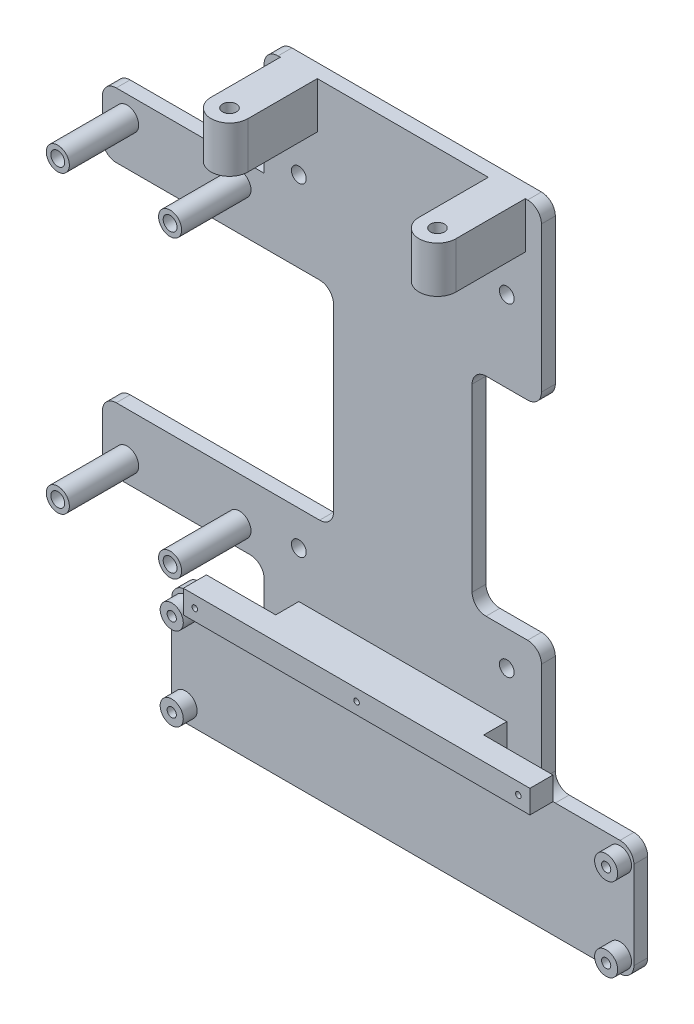
from build123d import *

# Parameters (mm, degrees)
SKETCH_1_W          = 60
SKETCH_1_H          = 100
EXTRUDE_1_DEPTH     = 3
CUT_EXTRUDE_1_REACH = 118.658
SKETCH_2_R          = 1.6
SKETCH_3_W          = 100
SKETCH_3_H          = 25
EXTRUDE_2_DEPTH     = 3
SKETCH_4_R          = 2.5
EXTRUDE_3_DEPTH     = 3
SKETCH_5_R          = 1
CUT_EXTRUDE_2_DEPTH = 129.202964084
SKETCH_6_W          = 45
SKETCH_6_H          = 5
EXTRUDE_4_DEPTH     = 5
SKETCH_7_W          = 75
SKETCH_7_H          = 5
EXTRUDE_5_DEPTH     = 5
SKETCH_8_R          = 0.6
CUT_EXTRUDE_3_DEPTH = 5
SKETCH_9_W          = 35
SKETCH_9_H          = 73
EXTRUDE_6_DEPTH     = 3
SKETCH_10_R         = 2.5
EXTRUDE_7_DEPTH     = 15
SKETCH_11_R         = 1.5
CUT_EXTRUDE_4_DEPTH = 10
SKETCH_12_W         = 60
SKETCH_12_H         = 10
EXTRUDE_8_DEPTH     = 28
CUT_EXTRUDE_5_REACH = 153.026
CUT_EXTRUDE_6_REACH = 160.458
SKETCH_14_R         = 1.5
CUT_EXTRUDE_7_REACH = 139.335
SKETCH_15_W         = 50
SKETCH_15_H         = 45
SKETCH_15_W_2       = 15
FILLET_1_R          = 3
FILLET_2_R          = 3
FILLET_3_R          = 3
FILLET_4_R          = 3
FILLET_5_R          = 3
FILLET_6_R          = 3


with BuildPart() as part:
    # 草图1 → 凸台-拉伸1 (new body)
    with BuildSketch(Plane.XY):
        with Locations((30, 50)):
            Rectangle(SKETCH_1_W, SKETCH_1_H)
    extrude(amount=EXTRUDE_1_DEPTH)

    # 草图2 → 切除-拉伸1 (cut, up to next)
    with BuildSketch(Plane.XY.offset(3), mode=Mode.PRIVATE) as cut_extrude_1_sk1:
        with Locations((7.5, 90)):
            Circle(SKETCH_2_R)
    cut_extrude_1_tool1 = extrude(cut_extrude_1_sk1.sketch, amount=-CUT_EXTRUDE_1_REACH, mode=Mode.PRIVATE) & part.part
    # 草图2 → 切除-拉伸1 (cut, up to next)
    with BuildSketch(Plane.XY.offset(3), mode=Mode.PRIVATE) as cut_extrude_1_sk2:
        with Locations((52.5, 90)):
            Circle(SKETCH_2_R)
    cut_extrude_1_tool2 = extrude(cut_extrude_1_sk2.sketch, amount=-CUT_EXTRUDE_1_REACH, mode=Mode.PRIVATE) & part.part
    # 草图2 → 切除-拉伸1 (cut, up to next)
    with BuildSketch(Plane.XY.offset(3), mode=Mode.PRIVATE) as cut_extrude_1_sk3:
        with Locations((52.5, 20)):
            Circle(SKETCH_2_R)
    cut_extrude_1_tool3 = extrude(cut_extrude_1_sk3.sketch, amount=-CUT_EXTRUDE_1_REACH, mode=Mode.PRIVATE) & part.part
    # 草图2 → 切除-拉伸1 (cut, up to next)
    with BuildSketch(Plane.XY.offset(3), mode=Mode.PRIVATE) as cut_extrude_1_sk4:
        with Locations((7.5, 20)):
            Circle(SKETCH_2_R)
    cut_extrude_1_tool4 = extrude(cut_extrude_1_sk4.sketch, amount=-CUT_EXTRUDE_1_REACH, mode=Mode.PRIVATE) & part.part
    add(cut_extrude_1_tool1.solids().sort_by_distance((7.5, 90, 3))[0], mode=Mode.SUBTRACT)
    add(cut_extrude_1_tool2.solids().sort_by_distance((52.5, 90, 3))[0], mode=Mode.SUBTRACT)
    add(cut_extrude_1_tool3.solids().sort_by_distance((52.5, 20, 3))[0], mode=Mode.SUBTRACT)
    add(cut_extrude_1_tool4.solids().sort_by_distance((7.5, 20, 3))[0], mode=Mode.SUBTRACT)

    # 草图3 → 凸台-拉伸2 (add)
    with BuildSketch(Plane.XY.offset(3)):
        with Locations((30, -12.5)):
            Rectangle(SKETCH_3_W, SKETCH_3_H)
    extrude(amount=-EXTRUDE_2_DEPTH)

    # 草图4 → 凸台-拉伸3 (add)
    with BuildSketch(Plane.XY.offset(3)):
        with Locations(Location((-17, -3.5, 0), (0, 0, 180))):
            Circle(SKETCH_4_R)
        with Locations(Location((-17, -21.5, 0), (0, 0, 180))):
            Circle(SKETCH_4_R)
        with Locations(Location((77, -21.5, 0), (0, 0, 180))):
            Circle(SKETCH_4_R)
        with Locations(Location((77, -3.5, 0), (0, 0, 180))):
            Circle(SKETCH_4_R)
    extrude(amount=EXTRUDE_3_DEPTH)

    # 草图5 → 切除-拉伸2 (cut, through all)
    with BuildSketch(Plane.XY.offset(6)):
        with Locations((-17, -3.5)):
            Circle(SKETCH_5_R)
        with Locations((-17, -21.5)):
            Circle(SKETCH_5_R)
        with Locations((77, -21.5)):
            Circle(SKETCH_5_R)
        with Locations((77, -3.5)):
            Circle(SKETCH_5_R)
    extrude(amount=-CUT_EXTRUDE_2_DEPTH, mode=Mode.SUBTRACT)

    # 草图6 → 凸台-拉伸4 (add)
    with BuildSketch(Plane.XY.offset(3)):
        with Locations((30, 7.5)):
            Rectangle(SKETCH_6_W, SKETCH_6_H)
    extrude(amount=EXTRUDE_4_DEPTH)

    # 草图7 → 凸台-拉伸5 (add)
    with BuildSketch(Plane.XY.offset(8)):
        with Locations((30, 7.5)):
            Rectangle(SKETCH_7_W, SKETCH_7_H)
    extrude(amount=EXTRUDE_5_DEPTH)

    # 草图8 → 切除-拉伸3 (cut)
    with BuildSketch(Plane.XY.offset(13)):
        with Locations((-5, 7.5)):
            Circle(SKETCH_8_R)
        with Locations((30, 7.5)):
            Circle(SKETCH_8_R)
        with Locations((65, 7.5)):
            Circle(SKETCH_8_R)
    extrude(amount=-CUT_EXTRUDE_3_DEPTH, mode=Mode.SUBTRACT)

    # 草图9 → 凸台-拉伸6 (add)
    with BuildSketch(Plane.XY.offset(3)):
        with Locations((-17.5, 50)):
            Rectangle(SKETCH_9_W, SKETCH_9_H)
    extrude(amount=-EXTRUDE_6_DEPTH)

    # 草图10 → 凸台-拉伸7 (add)
    with BuildSketch(Plane.XY.offset(3)):
        with Locations(Location((-29.65, 81.95, 0), (0, 0, 180))):
            Circle(SKETCH_10_R)
        with Locations(Location((-5.35, 81.95, 0), (0, 0, 180))):
            Circle(SKETCH_10_R)
        with Locations(Location((-5.35, 18.05, 0), (0, 0, 180))):
            Circle(SKETCH_10_R)
        with Locations(Location((-29.65, 18.05, 0), (0, 0, 180))):
            Circle(SKETCH_10_R)
    extrude(amount=EXTRUDE_7_DEPTH)

    # 草图11 → 切除-拉伸4 (cut)
    with BuildSketch(Plane.XY.offset(18)):
        with Locations((-29.65, 81.95)):
            Circle(SKETCH_11_R)
        with Locations((-5.35, 81.95)):
            Circle(SKETCH_11_R)
        with Locations((-5.35, 18.05)):
            Circle(SKETCH_11_R)
        with Locations((-29.65, 18.05)):
            Circle(SKETCH_11_R)
    extrude(amount=-CUT_EXTRUDE_4_DEPTH, mode=Mode.SUBTRACT)

    # 草图12 → 凸台-拉伸8 (add)
    with BuildSketch(Plane(origin=(0, 0, 0), x_dir=(-1, 0, 0), z_dir=(0, 0, -1))):
        with Locations((-30, 105)):
            Rectangle(SKETCH_12_W, SKETCH_12_H)
    extrude(amount=-EXTRUDE_8_DEPTH)

    # 草图13 → 切除-拉伸5 (cut, up to next)
    with BuildSketch(Plane.XZ.offset(-100), mode=Mode.PRIVATE) as cut_extrude_5_sk1:
        with BuildLine():
            Line((3.5, 3), (3.5, 18))
            ThreePointArc((3.5, 18), (7.5, 22), (11.5, 18))
            Line((11.5, 18), (11.5, 3))
            Line((11.5, 3), (48.5, 3))
            Line((48.5, 3), (48.5, 18))
            ThreePointArc((48.5, 18), (52.5, 22), (56.5, 18))
            Line((56.5, 18), (56.5, 3))
            Line((56.5, 3), (60, 3))
            Line((60, 3), (60, 28))
            Line((60, 28), (0, 28))
            Line((0, 28), (0, 3))
            Line((0, 3), (3.5, 3))
        make_face()
    cut_extrude_5_tool1 = extrude(cut_extrude_5_sk1.sketch, amount=-CUT_EXTRUDE_5_REACH, mode=Mode.PRIVATE) & part.part
    add(cut_extrude_5_tool1.solids().sort_by_distance((30, 100, 16.317537))[0], mode=Mode.SUBTRACT)

    # 草图14 → 切除-拉伸6 (cut, up to next)
    with BuildSketch(Plane(origin=(0, 110, 0), x_dir=(1, 0, 0), z_dir=(0, 1, 0)), mode=Mode.PRIVATE) as cut_extrude_6_sk1:
        with Locations(Location((7.5, -18, 0), (0, 0, 180))):
            Circle(SKETCH_14_R)
    cut_extrude_6_tool1 = extrude(cut_extrude_6_sk1.sketch, amount=-CUT_EXTRUDE_6_REACH, mode=Mode.PRIVATE) & part.part
    # 草图14 → 切除-拉伸6 (cut, up to next)
    with BuildSketch(Plane(origin=(0, 110, 0), x_dir=(1, 0, 0), z_dir=(0, 1, 0)), mode=Mode.PRIVATE) as cut_extrude_6_sk2:
        with Locations(Location((52.5, -18, 0), (0, 0, 180))):
            Circle(SKETCH_14_R)
    cut_extrude_6_tool2 = extrude(cut_extrude_6_sk2.sketch, amount=-CUT_EXTRUDE_6_REACH, mode=Mode.PRIVATE) & part.part
    add(cut_extrude_6_tool1.solids().sort_by_distance((7.5, 110, 18))[0], mode=Mode.SUBTRACT)
    add(cut_extrude_6_tool2.solids().sort_by_distance((52.5, 110, 18))[0], mode=Mode.SUBTRACT)

    # 草图15 → 切除-拉伸7 (cut, up to next)
    with BuildSketch(Plane.XY.offset(3), mode=Mode.PRIVATE) as cut_extrude_7_sk1:
        with Locations((-10, 50)):
            Rectangle(SKETCH_15_W, SKETCH_15_H)
    cut_extrude_7_tool1 = extrude(cut_extrude_7_sk1.sketch, amount=-CUT_EXTRUDE_7_REACH, mode=Mode.PRIVATE) & part.part
    # 草图15 → 切除-拉伸7 (cut, up to next)
    with BuildSketch(Plane.XY.offset(3), mode=Mode.PRIVATE) as cut_extrude_7_sk2:
        with Locations((52.5, 50)):
            Rectangle(SKETCH_15_W_2, SKETCH_15_H)
    cut_extrude_7_tool2 = extrude(cut_extrude_7_sk2.sketch, amount=-CUT_EXTRUDE_7_REACH, mode=Mode.PRIVATE) & part.part
    add(cut_extrude_7_tool1.solids().sort_by_distance((-10, 50, 3))[0], mode=Mode.SUBTRACT)
    add(cut_extrude_7_tool2.solids().sort_by_distance((52.5, 50, 3))[0], mode=Mode.SUBTRACT)

    # 圆角1
    fillet_1_edges = [part.edges().sort_by_distance(p)[0] for p in [
        (15, 27.5, 1.5),
    ]]
    fillet(fillet_1_edges, radius=FILLET_1_R)

    # 圆角2
    fillet_2_edges = [part.edges().sort_by_distance(p)[0] for p in [
        (15, 72.5, 1.5),
    ]]
    fillet(fillet_2_edges, radius=FILLET_2_R)

    # 圆角3
    fillet_3_edges = [part.edges().sort_by_distance(p)[0] for p in [
        (-35, 86.5, 1.5),
    ]]
    fillet(fillet_3_edges, radius=FILLET_3_R)

    # 圆角4
    fillet_4_edges = [part.edges().sort_by_distance(p)[0] for p in [
        (-35, 72.5, 1.5),
    ]]
    fillet(fillet_4_edges, radius=FILLET_4_R)

    # 圆角5
    fillet_5_edges = [part.edges().sort_by_distance(p)[0] for p in [
        (0, 110, 1.5),
    ]]
    fillet(fillet_5_edges, radius=FILLET_5_R)

    # 圆角6
    fillet_6_edges = [part.edges().sort_by_distance(p)[0] for p in [
        (-35, 13.5, 1.5),
        (0, 13.5, 1.5),
        (60, 110, 1.5),
        (-35, 27.5, 1.5),
        (45, 72.5, 1.5),
        (60, 72.5, 1.5),
        (60, 27.5, 1.5),
        (45, 27.5, 1.5),
        (-20, -25, 1.5),
        (-20, 0, 1.5),
        (80, 0, 1.5),
        (80, -25, 1.5),
        (60, 0, 1.5),
        (0, 0, 1.5),
    ]]
    fillet(fillet_6_edges, radius=FILLET_6_R)


solid = part.part
